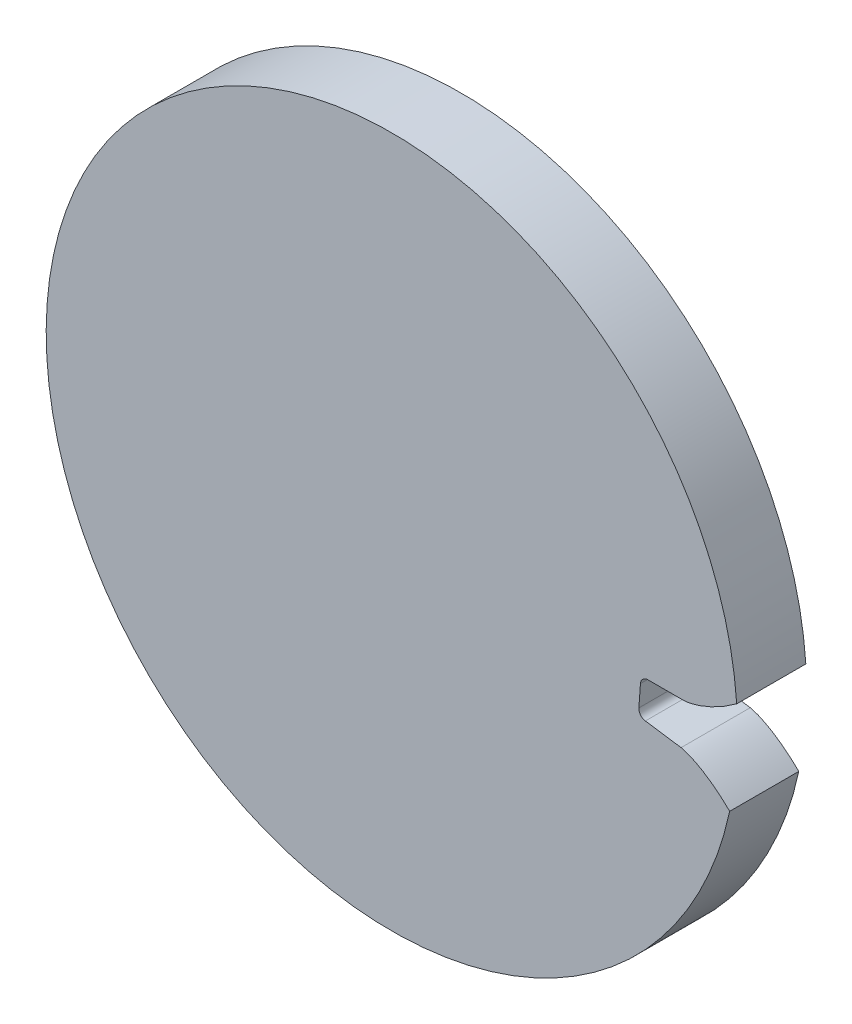
from build123d import *

# Parameters (mm, degrees)
SKETCH2_R               = 50
BOSS_EXTRUDE1_DEPTH     = 10
CUT_EXTRUDE1_DEPTH      = 72.414284285
CUT_EXTRUDE1_DEPTH_BACK = 72.414284285
FILLET2_R               = 1.1


with BuildPart() as part:
    # Sketch2 → Boss-Extrude1 (new body)
    with BuildSketch(Plane.XY):
        Circle(SKETCH2_R)
    extrude(amount=BOSS_EXTRUDE1_DEPTH)

    # Sketch4 → Cut-Extrude1 (cut, two sides: drawn at the far end of the back side and taken through both)
    with BuildSketch(Plane.XY.offset(10).offset(-CUT_EXTRUDE1_DEPTH_BACK)):
        with BuildLine():
            add(Edge.make_bspline(
                [(42.286167935, 0), (42.300623625, 0.000207972), (42.341158058, 0.001435323), (42.417735849, 0.006298791), (42.542526621, 0.017843628), (42.701219946, 0.037852947), (42.905849783, 0.069790126), (43.146163964, 0.115211019), (43.409330629, 0.17327731), (43.694480037, 0.245219326), (43.977805099, 0.324724197), (44.259247021, 0.411205938), (44.538460268, 0.503808989), (44.875197444, 0.623574823), (45.276841168, 0.777725041), (45.742862789, 0.973159706), (46.267095665, 1.212747198), (46.796326187, 1.475938928), (47.312791354, 1.750494209), (47.829241884, 2.045617008), (48.325100599, 2.343712939), (48.834136207, 2.671254069), (49.264664533, 2.95849553), (49.608043611, 3.202248044), (49.805138833, 3.344334313), (49.884141613, 3.401825328)],
                knots=[0, 0, 0, 0, 0, 0.005376749, 0.015083688, 0.02853182, 0.04661014, 0.064854849, 0.092110525, 0.119476176, 0.146842496, 0.174208854, 0.201574956, 0.228941013, 0.256307345, 0.307035032, 0.361767352, 0.416499661, 0.471231937, 0.525964282, 0.580696616, 0.635428982, 0.690161387, 0.744893688, 0.782595304, 0.782595304, 0.782595304, 0.782595304, 0.782595304], degree=4))
            Line((42.286167935, 0), (36.036167935, 0))
            Line((36.036167935, 0), (35.65943594, -5.197117271))
            Line((35.65943594, -5.197117271), (41.844096723, -6.098488999))
            add(Edge.make_bspline(
                [(41.844096723, -6.098488999), (41.858371296, -6.100779588), (41.898304962, -6.107839963), (41.973380782, -6.123696596), (42.095201966, -6.153118), (42.249350534, -6.195804805), (42.447235152, -6.256919711), (42.678486444, -6.336523746), (42.930527603, -6.431936755), (43.202320541, -6.544250768), (43.471217494, -6.663785466), (43.737244794, -6.78995251), (44.000183905, -6.921855451), (44.316128172, -7.088933279), (44.691341539, -7.299396816), (45.124305757, -7.559997748), (45.608504976, -7.872685118), (46.094245403, -8.209450717), (46.565715083, -8.555620057), (47.034204041, -8.922139787), (47.481887674, -9.288631826), (47.938363873, -9.686161599), (48.322965525, -10.03249073), (48.627600964, -10.323216938), (48.802144091, -10.492242768), (48.87202963, -10.560526495)],
                knots=[0, 0, 0, 0, 0, 0.005376749, 0.015083688, 0.02853182, 0.04661014, 0.064854849, 0.092110525, 0.119476176, 0.146842496, 0.174208854, 0.201574956, 0.228941013, 0.256307345, 0.307035032, 0.361767352, 0.416499661, 0.471231937, 0.525964282, 0.580696616, 0.635428982, 0.690161387, 0.744893688, 0.782595304, 0.782595304, 0.782595304, 0.782595304, 0.782595304], degree=4))
            ThreePointArc((48.87202963, -10.560526495), (49.717207693, -5.310297473), (50, 0))
            ThreePointArc((50, 0), (49.971027009, 1.701898846), (49.884141613, 3.401825328))
        make_face()
    extrude(amount=CUT_EXTRUDE1_DEPTH + CUT_EXTRUDE1_DEPTH_BACK, mode=Mode.SUBTRACT)

    # Fillet2
    fillet2_edges = [part.edges().sort_by_distance(p)[0] for p in [
        (36.036167935, 0, 5),
        (35.65943594, -5.197117271, 5),
    ]]
    fillet(fillet2_edges, radius=FILLET2_R)


solid = part.part
